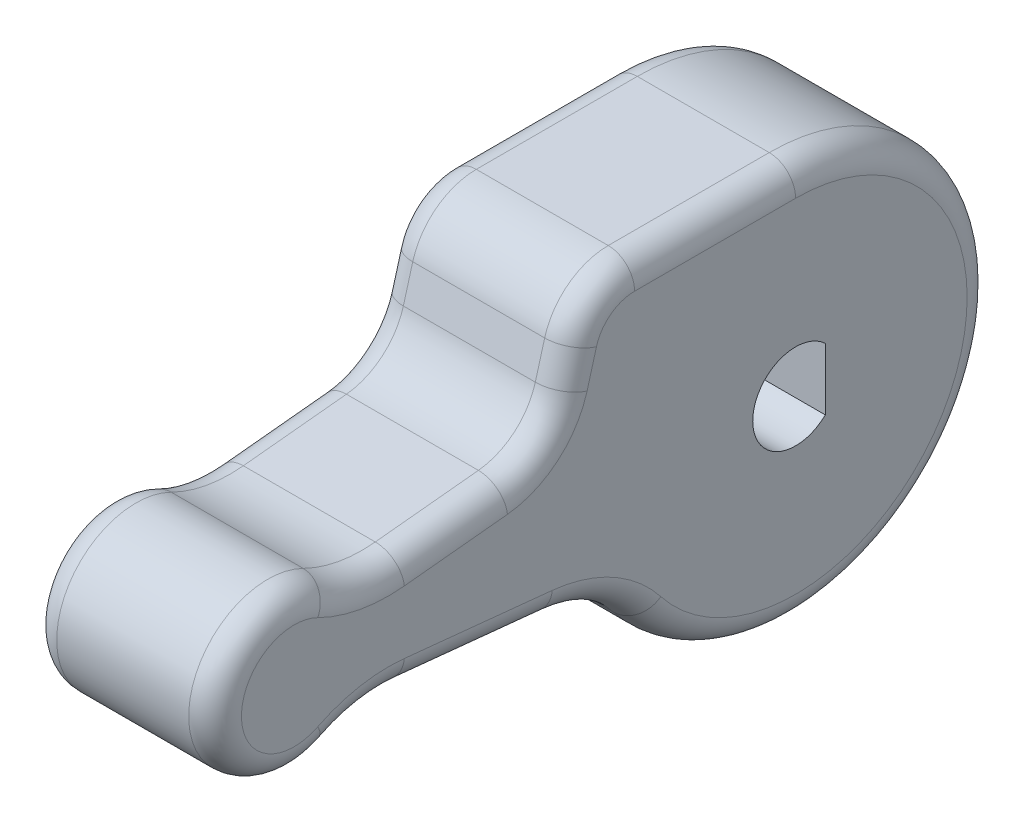
from build123d import *

# Parameters (mm, degrees)
BOSS_EXTRUDE1_DEPTH = 3.5
FILLET1_R           = 5
HOLE1_D             = 2.5
HOLE1_DEPTH         = 8
HOLE1_CBORE_D       = 3.5
HOLE1_CBORE_DEPTH   = 3
BOSS_EXTRUDE2_DEPTH = 7
FILLET3_R           = 2.5
FILLET2_R           = 1


with BuildPart() as part:
    # Sketch1 → Boss-Extrude1 (new, symmetric)
    with BuildSketch(Plane(origin=(0, 0, 0), x_dir=(0, 0, -1), z_dir=(1, 0, 0))):
        with BuildLine():
            Line((-16.763932023, 2), (-6.873863542, 3))
            ThreePointArc((-6.873863542, 3), (7.5, 0), (-6.873863542, -3))
            Line((-6.873863542, -3), (-16.763932023, -2))
            ThreePointArc((-16.763932023, -2), (-22, 0), (-16.763932023, 2))
        make_face()
        with BuildLine():
            Line((1.125, -1.17260394), (1.125, 1.17260394))
            ThreePointArc((1.125, 1.17260394), (-1.625, 0), (1.125, -1.17260394))
        make_face(mode=Mode.SUBTRACT)
    extrude(amount=BOSS_EXTRUDE1_DEPTH, both=True)

    # Fillet1
    fillet1_edges = [part.edges().sort_by_distance(p)[0] for p in [
        (0, 2, 16.763932023),
        (0, 3, 6.873863542),
        (0, -3, 6.873863542),
        (0, -2, 16.763932023),
    ]]
    fillet(fillet1_edges, radius=FILLET1_R)

    # Hole1
    with Locations(Plane(origin=(0, 0, -7.625), x_dir=(1, 0, 0), z_dir=(0, 0, -1))):
        with Locations((0, 0)):
            CounterBoreHole(HOLE1_D / 2, HOLE1_CBORE_D / 2, HOLE1_CBORE_DEPTH, depth=HOLE1_DEPTH)

    # Sketch4 → Boss-Extrude2 (add, through all)
    with BuildSketch(Plane(origin=(3.5, 0, 0), x_dir=(0, 0, -1), z_dir=(1, 0, 0))):
        with BuildLine():
            Line((0, 7.5), (-8, 7.5))
            Line((-8, 7.5), (-9.322631792, 2.752401285))
            ThreePointArc((-9.322631792, 2.752401285), (-7.417180104, 3.345325434), (-5.895374891, 4.63622205))
            ThreePointArc((-5.895374891, 4.63622205), (-3.277066876, 6.746171706), (0, 7.5))
        make_face()
    extrude(amount=-BOSS_EXTRUDE2_DEPTH)

    # Fillet3
    fillet3_edges = [part.edges().sort_by_distance(p)[0] for p in [
        (0, 2.752401285, 9.322631792),
        (0, 7.5, 8),
    ]]
    fillet(fillet3_edges, radius=FILLET3_R)

    # Fillet2
    fillet2_edges = [part.edges().sort_by_distance(p)[0] for p in [
        (-3.5, 0, 22),
        (3.5, 0, 22),
        (-3.5, -3.277066876, -6.746171706),
        (3.5, -3.277066876, -6.746171706),
        (-3.5, -2.468974793, 12.1257392),
        (3.5, -2.468974793, 12.1257392),
        (-3.5, 2.241658078, 16.330786257),
        (3.5, 2.241658078, 16.330786257),
        (-3.5, -3.345325434, 7.417180104),
        (3.5, -3.345325434, 7.417180104),
        (-3.5, -2.241658078, 16.330786257),
        (3.5, -2.241658078, 16.330786257),
        (-3.5, 7.5, 3.05063578),
        (3.5, 7.5, 3.05063578),
        (-3.5, 2.383100127, 12.975045529),
        (3.5, 2.383100127, 12.975045529),
        (3.5, 5.033984843, 8.687006262),
        (-3.5, 5.033984843, 8.687006262),
        (3.5, 6.990893204, 7.613337779),
        (-3.5, 6.990893204, 7.613337779),
        (-3.5, 3.155755504, 9.662325823),
        (3.5, 3.155755504, 9.662325823),
    ]]
    fillet(fillet2_edges, radius=FILLET2_R)


solid = part.part
